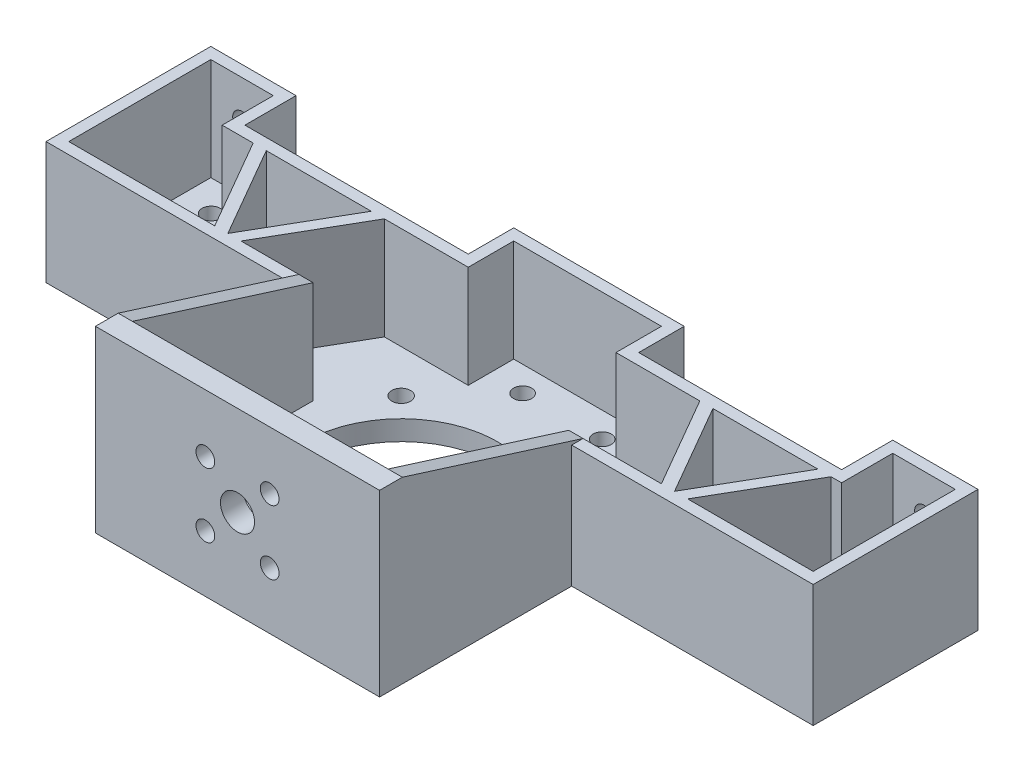
from build123d import *

# Parameters (mm, degrees)
SKETCH_2_R          = 1.6
SKETCH_2_R_2        = 17
SKETCH_2_R_3        = 1.65
EXTRUDE_2_DEPTH     = 3.5
EXTRUDE_3_DEPTH     = 18
EXTRUDE_4_DEPTH     = 10
CUT_EXTRUDE_5_DEPTH = 117.156532317
SKETCH_10_R         = 3
SKETCH_10_R_2       = 1.65
CUT_EXTRUDE_4_DEPTH = 5
EXTRUDE_5_DEPTH     = 18
SKETCH_14_R         = 1.65
CUT_EXTRUDE_6_DEPTH = 10


with BuildPart() as part:
    # 草图2 → 凸台-拉伸2 (new body)
    with BuildSketch(Plane(origin=(0, 0, 0), x_dir=(1, 0, 0), z_dir=(0, 1, 0))):
        Polygon((-42.5, 33.8), (-42.5, 62.8), (-27.5, 62.8), (-27.5, 53.8), (11.8, 53.8), (11.8, 61.8), (41.8, 61.8), (41.8, 53.8), (77.5, 53.8), (77.5, 62.8), (92.5, 62.8), (92.5, 33.8), (50, 33.8), (50, 0), (0, 0), (0, 33.8), align=None)
        with Locations(Location((-35, 55.365042575, 0), (0, 0, 270))):
            Circle(SKETCH_2_R, mode=Mode.SUBTRACT)
        with Locations(Location((85, 55.365042575, 0), (0, 0, 270))):
            Circle(SKETCH_2_R, mode=Mode.SUBTRACT)
        with Locations(Location((19.8, 55.365042575, 0), (0, 0, 270))):
            Circle(SKETCH_2_R, mode=Mode.SUBTRACT)
        with Locations(Location((33.8, 55.365042575, 0), (0, 0, 270))):
            Circle(SKETCH_2_R, mode=Mode.SUBTRACT)
        with Locations(Location((25, 28.8, 0), (0, 0, 270))):
            Circle(SKETCH_2_R_2, mode=Mode.SUBTRACT)
        with Locations(Location((40.5, 44.3, 0), (0, 0, 270))):
            Circle(SKETCH_2_R_3, mode=Mode.SUBTRACT)
        with Locations(Location((40.5, 13.3, 0), (0, 0, 270))):
            Circle(SKETCH_2_R_3, mode=Mode.SUBTRACT)
        with Locations(Location((9.5, 13.3, 0), (0, 0, 270))):
            Circle(SKETCH_2_R_3, mode=Mode.SUBTRACT)
        with Locations(Location((9.5, 44.3, 0), (0, 0, 270))):
            Circle(SKETCH_2_R_3, mode=Mode.SUBTRACT)
    extrude(amount=EXTRUDE_2_DEPTH)

    # 草图6 → 凸台-拉伸3 (add)
    with BuildSketch(Plane(origin=(0, 3.5, 0), x_dir=(1, 0, 0), z_dir=(0, 1, 0))):
        Polygon((11.8, 53.8), (-27.5, 53.8), (-27.5, 62.8), (-42.5, 62.8), (-42.5, 33.8), (0, 33.8), (0, 0), (50, 0), (50, 33.8), (92.5, 33.8), (92.5, 62.8), (77.5, 62.8), (77.5, 53.8), (41.8, 53.8), (41.8, 61.8), (11.8, 61.8), align=None)
        Polygon((13.8, 51.8), (-29.5, 51.8), (-29.5, 60.8), (-40.5, 60.8), (-40.5, 35.8), (2.5, 35.8), (2.5, 4), (47.5, 4), (47.5, 35.8), (90.5, 35.8), (90.5, 60.8), (79.5, 60.8), (79.5, 51.8), (39.8, 51.8), (39.8, 59.8), (13.8, 59.8), align=None, mode=Mode.SUBTRACT)
    extrude(amount=EXTRUDE_3_DEPTH)

    # 草图11 → 凸台-拉伸4 (add)
    with BuildSketch(Plane(origin=(0, 21.5, 0), x_dir=(1, 0, 0), z_dir=(0, 1, 0))):
        Polygon((2.5, 35.8), (2.5, 4), (47.5, 4), (47.5, 35.8), (50, 35.8), (50, 0), (0, 0), (0, 35.8), align=None)
    extrude(amount=EXTRUDE_4_DEPTH)

    # 草图12 → 切除-拉伸5 (cut, through all)
    with BuildSketch(Plane.ZY):
        Polygon((-35.8, 21.5), (-4, 31.5), (-35.8, 31.5), align=None)
    extrude(amount=-CUT_EXTRUDE_5_DEPTH, mode=Mode.SUBTRACT)

    # 草图10 → 切除-拉伸4 (cut)
    with BuildSketch(Plane.XY):
        with Locations((25, 15.656854249)):
            Circle(SKETCH_10_R)
        with Locations((30.656854249, 21.313708499)):
            Circle(SKETCH_10_R_2)
        with Locations((30.656854249, 10)):
            Circle(SKETCH_10_R_2)
        with Locations((19.343145751, 10)):
            Circle(SKETCH_10_R_2)
        with Locations((19.343145751, 21.313708499)):
            Circle(SKETCH_10_R_2)
    extrude(amount=-CUT_EXTRUDE_4_DEPTH, mode=Mode.SUBTRACT)

    # 草图13 → 凸台-拉伸5 (add)
    with BuildSketch(Plane(origin=(0, 3.5, 0), x_dir=(1, 0, 0), z_dir=(0, 1, 0))):
        Polygon((-12.5, 35.8), (-21.737604307, 51.8), (-24.047005384, 51.8), (-14.809401077, 35.8), align=None)
        Polygon((-3.262395693, 51.8), (-12.5, 35.8), (-10.190598923, 35.8), (-0.952994616, 51.8), align=None)
        Polygon((54.552994616, 51.8), (63.790598923, 35.8), (66.1, 35.8), (56.862395693, 51.8), align=None)
        Polygon((75.337604307, 51.8), (66.1, 35.8), (68.409401077, 35.8), (77.647005384, 51.8), align=None)
    extrude(amount=EXTRUDE_5_DEPTH)

    # 草图14 → 切除-拉伸6 (cut)
    with BuildSketch(Plane(origin=(0, 0, -62.8), x_dir=(-1, 0, 0), z_dir=(0, 0, -1))):
        with Locations((35, 14.7)):
            Circle(SKETCH_14_R)
        with Locations(Location((-85, 14.7, 0), (0, 0, 180))):
            Circle(SKETCH_14_R)
    extrude(amount=-CUT_EXTRUDE_6_DEPTH, mode=Mode.SUBTRACT)


solid = part.part
